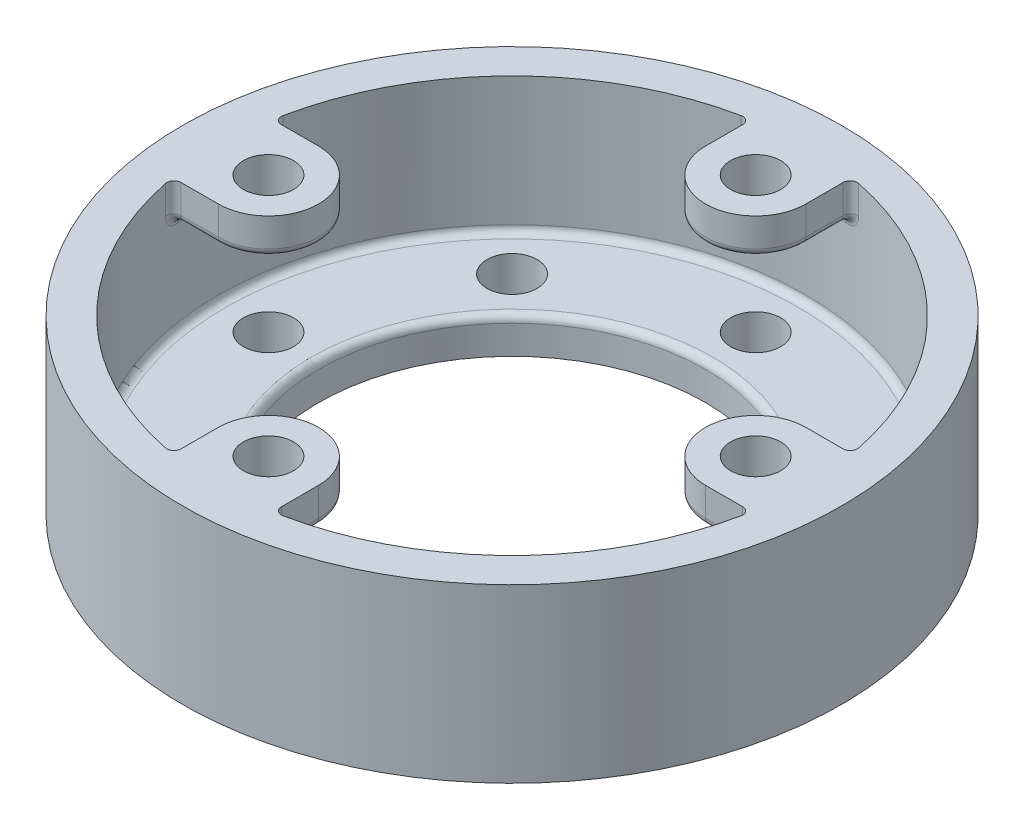
from build123d import *

# Parameters (mm, degrees)
SKETCH_2_R                       = 3.5
EXTRUDE_1_DEPTH                  = 5
SKETCH_3_R                       = 3.5
CUT_EXTRUDE_2_DEPTH              = 68.771675499
FILLET_1_R                       = 1
FILLET_2_R                       = 1
PATTERN_CIRCULAR_1_COUNT         = 4
FILLET_1_OF_PATTERN_CIRCULAR_1_R = 1
PATTERN_CIRCULAR_2_COUNT         = 8


with BuildPart() as part:
    # 草圖1 → 旋轉1 (revolve)
    with BuildSketch(Plane.XY, mode=Mode.PRIVATE) as revolve_1_sk:
        Polygon((27, 0), (27, 5), (41, 5), (41, 24), (46, 24), (46, 0), align=None)
    revolve(revolve_1_sk.sketch.rotate(Axis((0, 0, 0), (0, 1, 0)), 90), axis=Axis((0, 0, 0), (0, 1, 0)))

    # 草圖2 → 伸長1 (add)
    with BuildSketch(Plane(origin=(0, 24, 0), x_dir=(1, 0, 0), z_dir=(0, 1, 0))):
        with BuildLine():
            Line((-7, 40.398019753), (-7, 34))
            ThreePointArc((-7, 34), (0, 27), (7, 34))
            Line((7, 34), (7, 40.398019753))
            ThreePointArc((7, 40.398019753), (0, 41), (-7, 40.398019753))
        make_face()
        with Locations(Location((0, 34, 0), (0, 0, 270))):
            Circle(SKETCH_2_R, mode=Mode.SUBTRACT)
    extrude_1 = extrude(amount=-EXTRUDE_1_DEPTH)

    # 草圖3 → 伸長2 (cut, through all)
    with BuildSketch(Plane(origin=(0, 5, 0), x_dir=(1, 0, 0), z_dir=(0, 1, 0))):
        with Locations(Location((0, 34, 0), (0, 0, 270))):
            Circle(SKETCH_3_R)
    cut_extrude_2 = extrude(amount=-CUT_EXTRUDE_2_DEPTH, mode=Mode.SUBTRACT)

    # 圓角1
    fillet_1_edges = [part.edges().sort_by_distance(p)[0] for p in [
        (3.51291831, 19, -40.849227715),
        (-7, 21.5, -40.398019753),
        (7, 19, -37.199009877),
        (7, 21.5, -40.398019753),
        (0, 19, -27),
        (-7, 19, -37.199009877),
    ]]
    fillet(fillet_1_edges, radius=FILLET_1_R)

    # 圓角2
    fillet_2_edges = [part.edges().sort_by_distance(p)[0] for p in [
        (0, 5, 41),
        (0, 5, 27),
    ]]
    fillet(fillet_2_edges, radius=FILLET_2_R)

    # 環狀複製排列1: 伸長1 ×4 about axis
    pattern_circular_1_axis = Axis((0, 24, 0), (0, -1, 0))
    for i in range(1, PATTERN_CIRCULAR_1_COUNT):
        add(extrude_1.rotate(pattern_circular_1_axis, i * 360 / PATTERN_CIRCULAR_1_COUNT))

    # 圓角1 of 環狀複製排列1
    fillet_1_of_pattern_circular_1_edges = [part.edges().sort_by_distance(p)[0] for p in [
        (40.849227715, 19, 3.51291831),
        (40.398019753, 21.5, -7),
        (37.199009877, 19, 7),
        (40.398019753, 21.5, 7),
        (27, 19, 0),
        (37.199009877, 19, -7),
        (-3.51291831, 19, 40.849227715),
        (7, 21.5, 40.398019753),
        (-7, 19, 37.199009877),
        (-7, 21.5, 40.398019753),
        (0, 19, 27),
        (7, 19, 37.199009877),
        (-40.849227715, 19, -3.51291831),
        (-40.398019753, 21.5, 7),
        (-37.199009877, 19, -7),
        (-40.398019753, 21.5, -7),
        (-27, 19, 0),
        (-37.199009877, 19, 7),
    ]]
    fillet(fillet_1_of_pattern_circular_1_edges, radius=FILLET_1_OF_PATTERN_CIRCULAR_1_R)

    # 環狀複製排列2: 伸長2 ×8 about axis
    pattern_circular_2_axis = Axis((0, 0, 0), (0, 1, 0))
    for i in range(1, PATTERN_CIRCULAR_2_COUNT):
        add(cut_extrude_2.rotate(pattern_circular_2_axis, i * 360 / PATTERN_CIRCULAR_2_COUNT), mode=Mode.SUBTRACT)


solid = part.part
